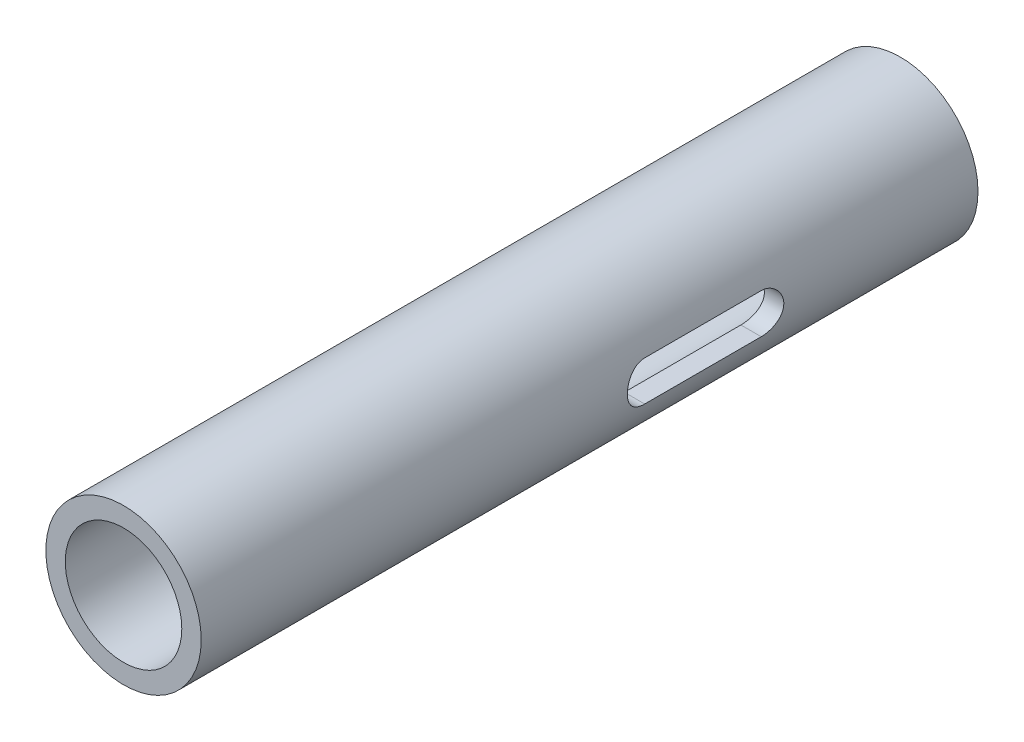
from build123d import *

# Parameters (mm, degrees)
SKETCH1_R               = 12.7
SKETCH1_R_2             = 9.525
BOSS_EXTRUDE1_DEPTH     = 127
CUT_EXTRUDE1_DEPTH      = 129.263712717
CUT_EXTRUDE1_DEPTH_BACK = 129.263712717


with BuildPart() as part:
    # Sketch1 → Boss-Extrude1 (new body)
    with BuildSketch(Plane.XY):
        Circle(SKETCH1_R)
        Circle(SKETCH1_R_2, mode=Mode.SUBTRACT)
    extrude(amount=BOSS_EXTRUDE1_DEPTH)

    # Sketch2 → Cut-Extrude1 (cut, two sides: drawn at the far end of the back side and taken through both)
    with BuildSketch(Plane(origin=(0, 0, 0), x_dir=(0, 0, -1), z_dir=(1, 0, 0)).offset(-CUT_EXTRUDE1_DEPTH_BACK)):
        with BuildLine():
            Line((-35.0139, -3.2639), (-54.0639, -3.2639))
            ThreePointArc((-54.0639, -3.2639), (-57.3278, 0), (-54.0639, 3.2639))
            Line((-54.0639, 3.2639), (-35.0139, 3.2639))
            ThreePointArc((-35.0139, 3.2639), (-31.75, 0), (-35.0139, -3.2639))
        make_face()
    extrude(amount=CUT_EXTRUDE1_DEPTH + CUT_EXTRUDE1_DEPTH_BACK, mode=Mode.SUBTRACT)


solid = part.part
